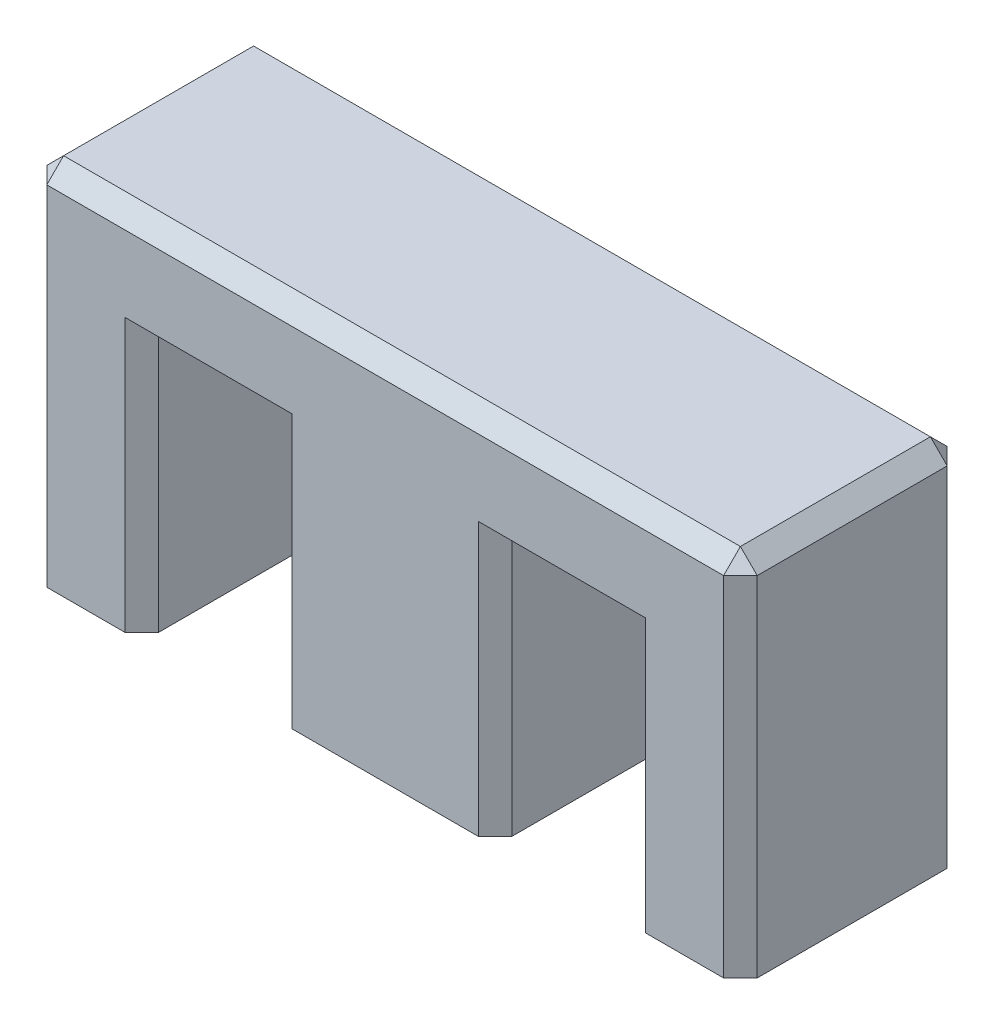
from build123d import *

# Parameters (mm, degrees)
BOSS_EXTRUDE1_DEPTH = 13.3
CHAMFER1_SIZE       = 2


with BuildPart() as part:
    # Sketch1 → Boss-Extrude1 (new, symmetric)
    with BuildSketch(Plane.XY):
        Polygon((42.25, 31.023529412), (-42.25, 31.023529412), (-42.25, -12.426470588), (-28.95, -12.426470588), (-28.95, 18.023529412), (-13.075, 18.023529412), (-13.075, -12.426470588), (13.075, -12.426470588), (13.075, 18.023529412), (28.95, 18.023529412), (28.95, -12.426470588), (42.25, -12.426470588), align=None)
    extrude(amount=BOSS_EXTRUDE1_DEPTH, both=True)

    # Chamfer1
    chamfer1_edges = [part.edges().sort_by_distance(p)[0] for p in [
        (13.075, 2.798529412, -13.3),
        (-13.075, 2.798529412, -13.3),
        (-21.0125, 18.023529412, -13.3),
        (-28.95, 2.798529412, -13.3),
        (-42.25, 9.298529412, -13.3),
        (0, 31.023529412, -13.3),
        (42.25, 9.298529412, -13.3),
        (28.95, 2.798529412, -13.3),
        (21.0125, 18.023529412, -13.3),
        (42.25, 9.298529412, 13.3),
        (0, 31.023529412, 13.3),
        (-42.25, 31.023529412, 0),
        (42.25, 31.023529412, 0),
        (-42.25, 9.298529412, 13.3),
        (-28.95, 2.798529412, 13.3),
        (-21.0125, 18.023529412, 13.3),
        (-13.075, 2.798529412, 13.3),
        (13.075, 2.798529412, 13.3),
        (21.0125, 18.023529412, 13.3),
        (28.95, 2.798529412, 13.3),
    ]]
    chamfer(chamfer1_edges, length=CHAMFER1_SIZE)


solid = part.part
